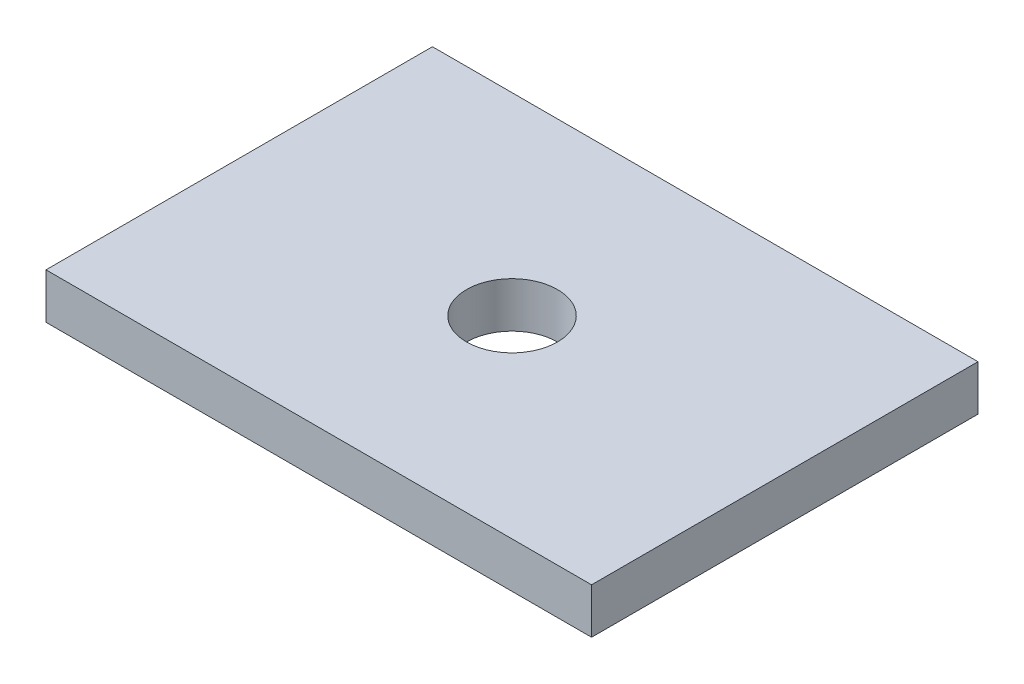
from build123d import *

# Parameters (mm, degrees)
SKETCH1_W           = 48
SKETCH1_H           = 34
SKETCH1_R           = 4
BOSS_EXTRUDE1_DEPTH = 4


with BuildPart() as part:
    # Sketch1 → Boss-Extrude1 (new body)
    with BuildSketch(Plane(origin=(0, 0, 0), x_dir=(1, 0, 0), z_dir=(0, 1, 0))):
        Rectangle(SKETCH1_W, SKETCH1_H)
        with Locations(Location((0, 0, 0), (0, 0, 270))):
            Circle(SKETCH1_R, mode=Mode.SUBTRACT)
    extrude(amount=BOSS_EXTRUDE1_DEPTH)


solid = part.part
